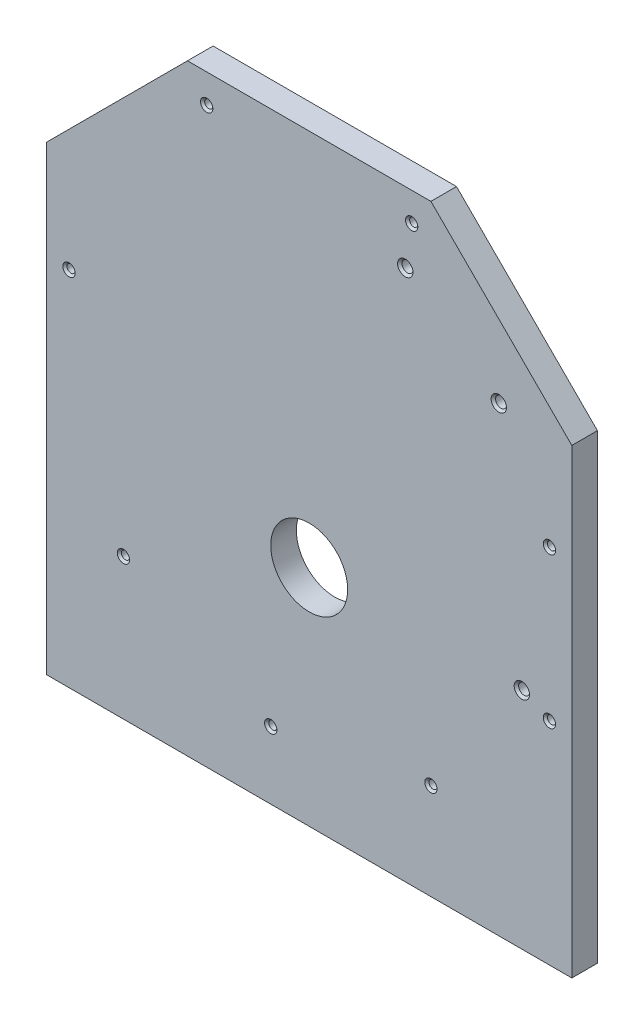
from build123d import *

# Parameters (mm, degrees)
BOSS_EXTRUDE1_DEPTH              = 12.7
SKETCH2_R                        = 19.0754
CUT_EXTRUDE2_DEPTH               = 214.127417875
F_10_32_TAPPED_HOLE2_AT_2_COUNT  = 2
F_10_32_TAPPED_HOLE2_AT_2_PITCH  = 101.6
F_10_32_TAPPED_HOLE2_AT_3_COUNT  = 2
F_10_32_TAPPED_HOLE2_AT_3_PITCH  = 199.581369562
F_10_32_TAPPED_HOLE2_AT_4_COUNT  = 2
F_10_32_TAPPED_HOLE2_AT_4_PITCH  = 257.571569241
F_10_32_TAPPED_HOLE2_AT_5_COUNT  = 2
F_10_32_TAPPED_HOLE2_AT_5_PITCH  = 260.369359036
F_10_32_TAPPED_HOLE2_AT_6_COUNT  = 2
F_10_32_TAPPED_HOLE2_AT_6_PITCH  = 236.729200842
F_10_32_TAPPED_HOLE2_AT_7_COUNT  = 2
F_10_32_TAPPED_HOLE2_AT_7_PITCH  = 125.046561074
F_10_32_TAPPED_HOLE2_AT_8_COUNT  = 2
F_10_32_TAPPED_HOLE2_AT_8_PITCH  = 191.941079739
F_1_4_28_TAPPED_HOLE1_AT_2_COUNT = 2
F_1_4_28_TAPPED_HOLE1_AT_2_PITCH = 118.029744238
F_1_4_28_TAPPED_HOLE1_AT_3_COUNT = 2
F_1_4_28_TAPPED_HOLE1_AT_3_PITCH = 162.987319215


with BuildPart() as part:
    # Sketch1 → Boss-Extrude1 (new body)
    with BuildSketch(Plane.XY):
        Polygon((-130.175, -168.275), (130.175, -168.275), (130.175, 60.325), (60.325, 130.175), (-60.325, 130.175), (-130.175, 60.325), align=None)
    extrude(amount=BOSS_EXTRUDE1_DEPTH)

    # Sketch2 → Cut-Extrude2 (cut, through all)
    with BuildSketch(Plane.XY):
        with Locations((0, -57.15)):
            Circle(SKETCH2_R)
    extrude(amount=CUT_EXTRUDE2_DEPTH, mode=Mode.SUBTRACT)

    # Sketch5 → #10-32 Tapped Hole2 (revolve, cut)
    with BuildSketch(Plane(origin=(50.8, 115.8875, 0), x_dir=(0, 1, 0), z_dir=(1, 0, 0))):
        Polygon((0, 0), (0, 12.7), (3.048, 12.7), (2.0193, 11.6713), (2.0193, 1.0287), (3.048, 0), align=None)
    f_10_32_tapped_hole2 = revolve(axis=Axis((50.8, 115.8875, -6.35), (0, 0, 1)), mode=Mode.SUBTRACT)

    # #10-32 Tapped Hole2 at 2: #10-32 Tapped Hole2 ×2
    with Locations(*[(-i * F_10_32_TAPPED_HOLE2_AT_2_PITCH, 0, 0) for i in range(1, F_10_32_TAPPED_HOLE2_AT_2_COUNT)]):
        add(f_10_32_tapped_hole2, mode=Mode.SUBTRACT)

    # #10-32 Tapped Hole2 at 3: #10-32 Tapped Hole2 ×2
    with Locations(*[Vector(-0.8511576023985749, -0.5249102169696354, 0) * (i * F_10_32_TAPPED_HOLE2_AT_3_PITCH) for i in range(1, F_10_32_TAPPED_HOLE2_AT_3_COUNT)]):
        add(f_10_32_tapped_hole2, mode=Mode.SUBTRACT)

    # #10-32 Tapped Hole2 at 4: #10-32 Tapped Hole2 ×2
    with Locations(*[Vector(-0.5547001962252293, -0.8320502943378437, 0) * (i * F_10_32_TAPPED_HOLE2_AT_4_PITCH) for i in range(1, F_10_32_TAPPED_HOLE2_AT_4_COUNT)]):
        add(f_10_32_tapped_hole2, mode=Mode.SUBTRACT)

    # #10-32 Tapped Hole2 at 5: #10-32 Tapped Hole2 ×2
    with Locations(*[Vector(-0.26827273477386476, -0.963343002142514, 0) * (i * F_10_32_TAPPED_HOLE2_AT_5_PITCH) for i in range(1, F_10_32_TAPPED_HOLE2_AT_5_COUNT)]):
        add(f_10_32_tapped_hole2, mode=Mode.SUBTRACT)

    # #10-32 Tapped Hole2 at 6: #10-32 Tapped Hole2 ×2
    with Locations(*[Vector(0.04023584739915886, -0.9991902104124478, 0) * (i * F_10_32_TAPPED_HOLE2_AT_6_PITCH) for i in range(1, F_10_32_TAPPED_HOLE2_AT_6_COUNT)]):
        add(f_10_32_tapped_hole2, mode=Mode.SUBTRACT)

    # #10-32 Tapped Hole2 at 7: #10-32 Tapped Hole2 ×2
    with Locations(*[Vector(0.5459982218929023, -0.8377863341507721, 0) * (i * F_10_32_TAPPED_HOLE2_AT_7_PITCH) for i in range(1, F_10_32_TAPPED_HOLE2_AT_7_COUNT)]):
        add(f_10_32_tapped_hole2, mode=Mode.SUBTRACT)

    # #10-32 Tapped Hole2 at 8: #10-32 Tapped Hole2 ×2
    with Locations(*[Vector(0.35570915873202924, -0.9345967014676182, 0) * (i * F_10_32_TAPPED_HOLE2_AT_8_PITCH) for i in range(1, F_10_32_TAPPED_HOLE2_AT_8_COUNT)]):
        add(f_10_32_tapped_hole2, mode=Mode.SUBTRACT)

    # Sketch7 → 1/4-28 Tapped Hole1 (revolve, cut)
    with BuildSketch(Plane(origin=(105.41, -57.15, 0), x_dir=(0, 1, 0), z_dir=(1, 0, 0))):
        Polygon((0, 0), (0, 12.7), (3.81, 12.7), (2.7051, 11.5951), (2.7051, 1.1049), (3.81, 0), align=None)
    f_1_4_28_tapped_hole1 = revolve(axis=Axis((105.41, -57.15, -6.35), (0, 0, 1)), mode=Mode.SUBTRACT)

    # 1/4-28 Tapped Hole1 at 2: 1/4-28 Tapped Hole1 ×2
    with Locations(*[Vector(-0.09683999633944815, 0.9952999623776622, 0) * (i * F_1_4_28_TAPPED_HOLE1_AT_2_PITCH) for i in range(1, F_1_4_28_TAPPED_HOLE1_AT_2_COUNT)]):
        add(f_1_4_28_tapped_hole1, mode=Mode.SUBTRACT)

    # 1/4-28 Tapped Hole1 at 3: 1/4-28 Tapped Hole1 ×2
    with Locations(*[Vector(-0.35453678407740086, 0.9350420678964421, 0) * (i * F_1_4_28_TAPPED_HOLE1_AT_3_PITCH) for i in range(1, F_1_4_28_TAPPED_HOLE1_AT_3_COUNT)]):
        add(f_1_4_28_tapped_hole1, mode=Mode.SUBTRACT)


solid = part.part
